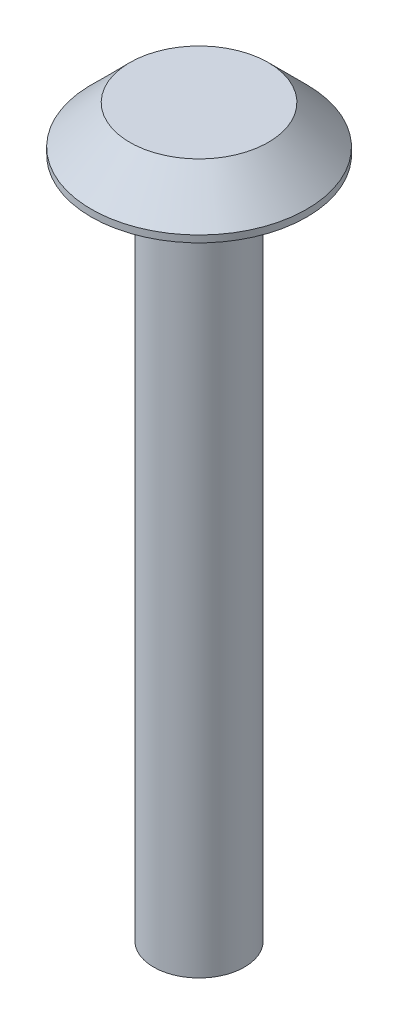
from build123d import *

# Parameters (mm, degrees)
SKETCH1_R           = 2
BOSS_EXTRUDE1_DEPTH = 30
SKETCH2_R           = 4.75
BOSS_EXTRUDE2_DEPTH = 2
CHAMFER1_SIZE       = 1.7


with BuildPart() as part:
    # Sketch1 → Boss-Extrude1 (new body)
    with BuildSketch(Plane(origin=(0, 0, 0), x_dir=(1, 0, 0), z_dir=(0, 1, 0))):
        with Locations(Location((0, 0, 0), (0, 0, 270))):
            Circle(SKETCH1_R)
    extrude(amount=BOSS_EXTRUDE1_DEPTH)

    # Sketch2 → Boss-Extrude2 (add)
    with BuildSketch(Plane(origin=(0, 30, 0), x_dir=(1, 0, 0), z_dir=(0, 1, 0))):
        with Locations(Location((0, 0, 0), (0, 0, 270))):
            Circle(SKETCH2_R)
    extrude(amount=BOSS_EXTRUDE2_DEPTH)

    # Chamfer1
    chamfer1_edges = [part.edges().sort_by_distance(p)[0] for p in [
        (0, 32, -4.75),
    ]]
    chamfer(chamfer1_edges, length=CHAMFER1_SIZE)


solid = part.part
